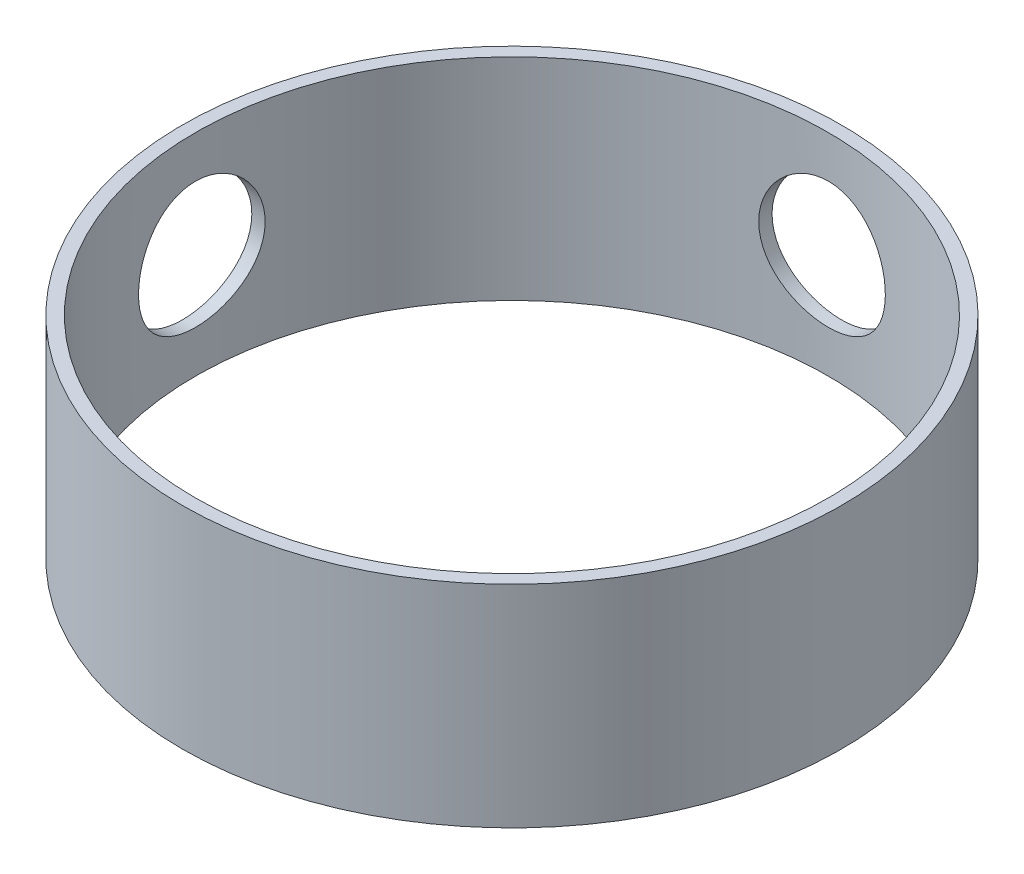
from build123d import *

# Parameters (mm, degrees)
SKETCH1_R           = 39.6748
SKETCH1_R_2         = 38.1
BOSS_EXTRUDE1_DEPTH = 12.7
SKETCH2_R           = 7.62
CUT_EXTRUDE1_DEPTH  = 58.527988928
SKETCH3_R           = 7.62
CUT_EXTRUDE2_DEPTH  = 58.527989088


with BuildPart() as part:
    # Sketch1 → Boss-Extrude1 (new, symmetric)
    with BuildSketch(Plane(origin=(0, 0, 0), x_dir=(1, 0, 0), z_dir=(0, 1, 0))):
        with Locations(Location((0, 0, 0), (0, 0, 270))):
            Circle(SKETCH1_R)
        with Locations(Location((0, 0, 0), (0, 0, 270))):
            Circle(SKETCH1_R_2, mode=Mode.SUBTRACT)
    extrude(amount=BOSS_EXTRUDE1_DEPTH, both=True)

    # Sketch2 → Cut-Extrude1 (cut, through all)
    with BuildSketch(Plane.XY):
        with Locations(Location((0, 0, 0), (0, 0, 90))):
            Circle(SKETCH2_R)
    extrude(amount=-CUT_EXTRUDE1_DEPTH, mode=Mode.SUBTRACT)

    # Sketch3 → Cut-Extrude2 (cut, through all)
    with BuildSketch(Plane(origin=(0, 0, 0), x_dir=(0, 0, -1), z_dir=(1, 0, 0))):
        Circle(SKETCH3_R)
    extrude(amount=-CUT_EXTRUDE2_DEPTH, mode=Mode.SUBTRACT)


solid = part.part
